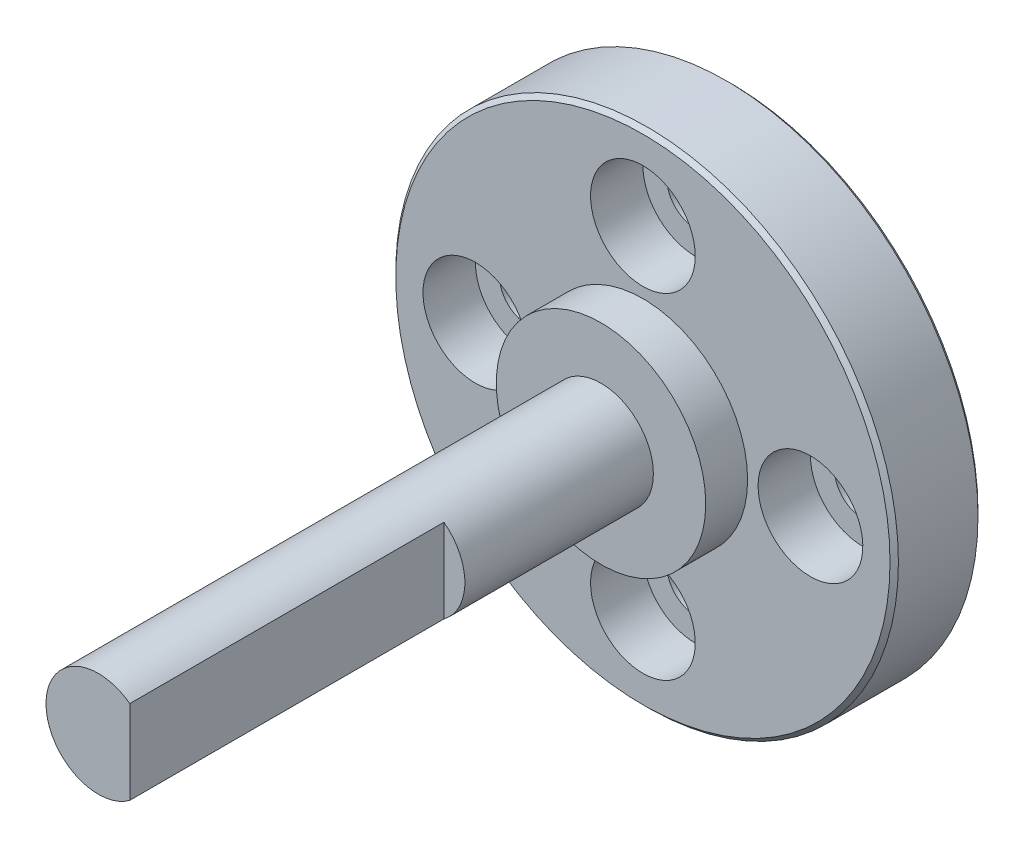
from build123d import *

# Parameters (mm, degrees)
SKETCH_1_R                     = 12
SKETCH_1_R_2                   = 3
EXTRUDE_1_DEPTH                = 4.2
SKETCH_2_R                     = 5
EXTRUDE_2_DEPTH                = 2
HOLE_WIZARD_M2_5_1_D           = 2.7
HOLE_WIZARD_M2_5_1_CBORE_D     = 5
HOLE_WIZARD_M2_5_1_CBORE_DEPTH = 2.5
PATTERN_CIRCULAR_1_COUNT       = 4
CHAMFER_3_SIZE                 = 0.2
SKETCH_12_R                    = 2.5
EXTRUDE_1650_DEPTH             = 26
CUT_EXTRUDE_START              = -15
CUT_EXTRUDE_1_DEPTH            = 15


with BuildPart() as part:
    # 草图1 → 凸台-拉伸1 (new body)
    # profile 1 of 2: a face of its own
    with BuildSketch(Plane.XY):
        Circle(SKETCH_1_R)
        Circle(SKETCH_1_R_2, mode=Mode.SUBTRACT)
    # profile 2 of 2: a face of its own
    with BuildSketch(Plane.XY):
        Circle(SKETCH_1_R_2)
    extrude(amount=EXTRUDE_1_DEPTH)

    # 草图2 → 凸台-拉伸2 (add)
    with BuildSketch(Plane.XY.offset(4.2)):
        Circle(SKETCH_2_R)
    extrude(amount=EXTRUDE_2_DEPTH)

    # M2.5 六角圆柱头螺钉的柱形沉头孔1 (through all)
    with Locations(Plane.XY.offset(4.2)):
        with Locations((0, 8)):
            hole_wizard_m2_5_1 = CounterBoreHole(HOLE_WIZARD_M2_5_1_D / 2, HOLE_WIZARD_M2_5_1_CBORE_D / 2, HOLE_WIZARD_M2_5_1_CBORE_DEPTH)

    # 阵列(圆周)1: M2.5 六角圆柱头螺钉的柱形沉头孔1 ×4 about axis
    pattern_circular_1_axis = Axis((0, 0, 0), (0, 0, 1))
    for i in range(1, PATTERN_CIRCULAR_1_COUNT):
        add(hole_wizard_m2_5_1.rotate(pattern_circular_1_axis, i * 360 / PATTERN_CIRCULAR_1_COUNT), mode=Mode.SUBTRACT)

    # 倒角3
    chamfer_3_edges = [part.edges().sort_by_distance(p)[0] for p in [
        (-12, 0, 0),
        (-12, 0, 4.2),
    ]]
    chamfer(chamfer_3_edges, length=CHAMFER_3_SIZE)

    # 草图12 → Extrude 1650 (add)
    with BuildSketch(Plane.XY.offset(4.2)):
        with Locations(Location((0, 0, 0), (0, 0, 180))):
            Circle(SKETCH_12_R)
    extrude(amount=EXTRUDE_1650_DEPTH)

    # 草图13 → 切除-拉伸1 (cut)
    with BuildSketch(Plane.XY.offset(30.2).offset(CUT_EXTRUDE_START)):
        with BuildLine():
            Line((1.5, 2), (1.5, -2))
            ThreePointArc((1.5, -2), (2.5, 0), (1.5, 2))
        make_face()
    extrude(amount=CUT_EXTRUDE_1_DEPTH, mode=Mode.SUBTRACT)


solid = part.part
